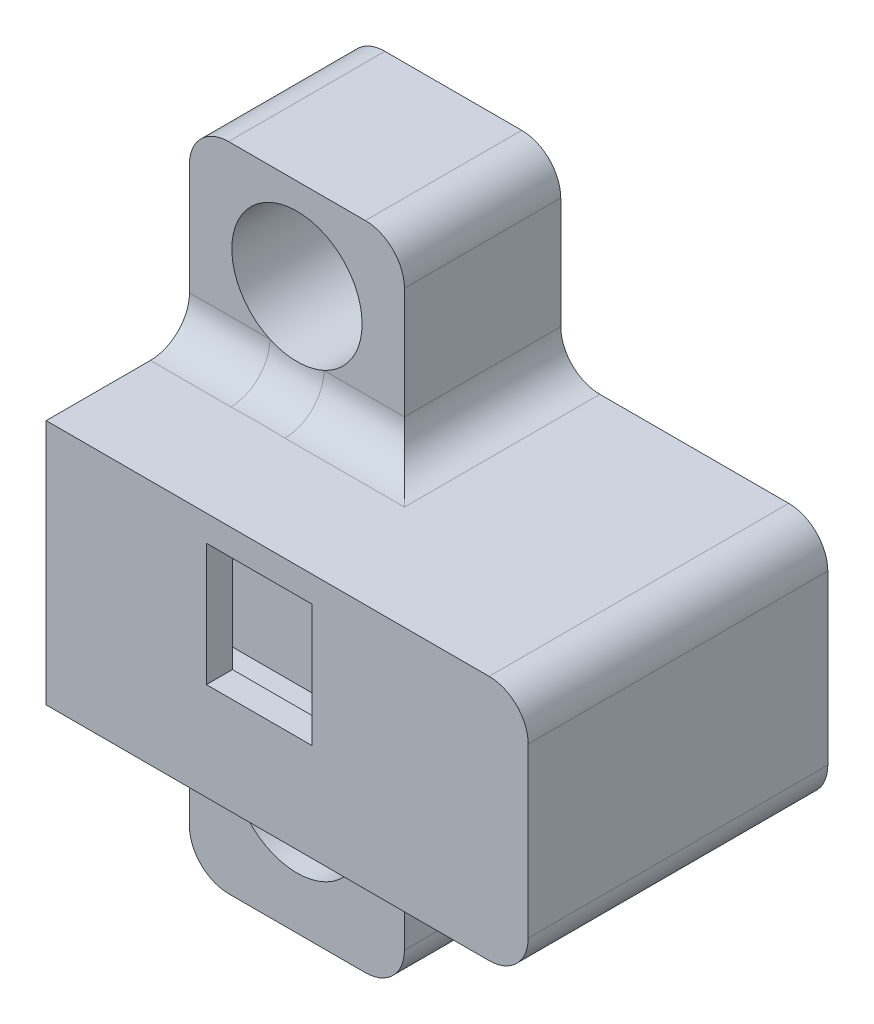
from build123d import *

# Parameters (mm, degrees)
CROQUIS1_W                 = 37
CROQUIS1_H                 = 18.9
SALIENTE_EXTRUIR1_DEPTH    = 9
VACIADO1_T                 = -2
CROQUIS2_W                 = 12.8
CROQUIS2_H                 = 12.3
CORTAR_EXTRUIR1_DEPTH      = 9
CROQUIS3_R                 = 2.5
SALIENTE_EXTRUIR2_DEPTH    = 12
CROQUIS4_R                 = 5
CORTAR_EXTRUIR2_DEPTH      = 9
REDONDEO1_R                = 3
CORTAR_EXTRUIR3_DEPTH      = 52.806394393
CORTAR_EXTRUIR3_DEPTH_BACK = 52.806394393
CROQUIS5_W                 = 8
CROQUIS5_H                 = 10
SALIENTE_EXTRUIR3_DEPTH    = 2
SALIENTE_EXTRUIR4_START    = 2
SALIENTE_EXTRUIR4_DEPTH    = 2
REDONDEO2_R                = 3


with BuildPart() as part:
    # Croquis1 → Saliente-Extruir1 (new body)
    with BuildSketch(Plane.XY):
        with Locations((18.5, 9.45)):
            Rectangle(CROQUIS1_W, CROQUIS1_H)
    extrude(amount=SALIENTE_EXTRUIR1_DEPTH)

    # Vaciado1
    vaciado1_openings = [part.faces().sort_by_distance(p)[0] for p in [
        (18.5, 9.45, 9),
    ]]
    offset(amount=VACIADO1_T, openings=vaciado1_openings, kind=Kind.INTERSECTION)

    # Croquis2 → Cortar-Extruir1 (cut)
    with BuildSketch(Plane.ZY):
        with Locations((9, 9.45)):
            Rectangle(CROQUIS2_W, CROQUIS2_H)
    extrude(amount=-CORTAR_EXTRUIR1_DEPTH, mode=Mode.SUBTRACT)

    # Croquis3 → Saliente-Extruir2 (add)
    with BuildSketch(Plane(origin=(0, 0, 0), x_dir=(-1, 0, 0), z_dir=(0, 0, -1))):
        Polygon((-16.5, -16.55), (0, -16.55), (0, 33.45), (-16.5, 33.45), (-16.5, 18.9), (-37, 18.9), (-37, 0), (-16.5, 0), align=None)
        with Locations((-8.25, 26.45)):
            Circle(CROQUIS3_R, mode=Mode.SUBTRACT)
        with Locations((-8.25, -7.55)):
            Circle(CROQUIS3_R, mode=Mode.SUBTRACT)
    extrude(amount=SALIENTE_EXTRUIR2_DEPTH)

    # Croquis4 → Cortar-Extruir2 (cut)
    with BuildSketch(Plane.XY):
        with Locations((8.25, -7.55)):
            Circle(CROQUIS4_R)
        with Locations((8.25, 26.45)):
            Circle(CROQUIS4_R)
    extrude(amount=-CORTAR_EXTRUIR2_DEPTH, mode=Mode.SUBTRACT)

    # Redondeo1
    redondeo1_edges = [part.edges().sort_by_distance(p)[0] for p in [
        (16.5, 33.45, -6),
        (16.5, 18.9, -6),
        (16.5, 0, -6),
        (16.5, -16.55, -6),
        (0, -16.55, -6),
        (0, 33.45, -6),
        (37, 18.9, -1.5),
        (37, 0, -1.5),
    ]]
    fillet(redondeo1_edges, radius=REDONDEO1_R)

    # Croquis5 → Cortar-Extruir3 (cut, two sides: drawn at the far end of the back side and taken through both)
    with BuildSketch(Plane.XY.offset(2).offset(-CORTAR_EXTRUIR3_DEPTH_BACK)):
        with Locations((31, 9.45)):
            Rectangle(CROQUIS5_W, CROQUIS5_H)
    extrude(amount=CORTAR_EXTRUIR3_DEPTH + CORTAR_EXTRUIR3_DEPTH_BACK, mode=Mode.SUBTRACT)

    # Croquis7 → Saliente-Extruir3 (add)
    with BuildSketch(Plane.XY.offset(9)):
        Polygon((0, 18.9), (12.3, 18.9), (12.3, 7.5), (20.514130343, 7.5), (20.514130343, 2), (20.514130343, 0), (12.3, 0), (0, 0), align=None)
    extrude(amount=SALIENTE_EXTRUIR3_DEPTH)

    # Croquis8 → Saliente-Extruir4 (add)
    with BuildSketch(Plane.XY.offset(9).offset(SALIENTE_EXTRUIR4_START)):
        with BuildLine():
            Line((35, 2), (20.514130343, 2))
            Line((20.514130343, 2), (20.514130343, 0))
            Line((20.514130343, 0), (34, 0))
            ThreePointArc((34, 0), (36.121320344, 0.878679656), (37, 3))
            Line((37, 3), (37, 15.9))
            ThreePointArc((37, 15.9), (36.121320344, 18.021320344), (34, 18.9))
            Line((34, 18.9), (12.3, 18.9))
            Line((12.3, 18.9), (12.3, 16.9))
            Line((12.3, 16.9), (20.389072173, 16.9))
            Line((20.389072173, 16.9), (35, 16.9))
            Line((35, 16.9), (35, 2))
        make_face()
        Polygon((20.389072173, 2), (20.514130343, 2), (35, 2), (35, 16.9), (20.389072173, 16.9), align=None)
    extrude(amount=-SALIENTE_EXTRUIR4_DEPTH)

    # Redondeo2
    redondeo2_edges = [part.edges().sort_by_distance(p)[0] for p in [
        (9.75, 18.9, 0),
        (9.75, 0, 0),
    ]]
    fillet(redondeo2_edges, radius=REDONDEO2_R)


solid = part.part
